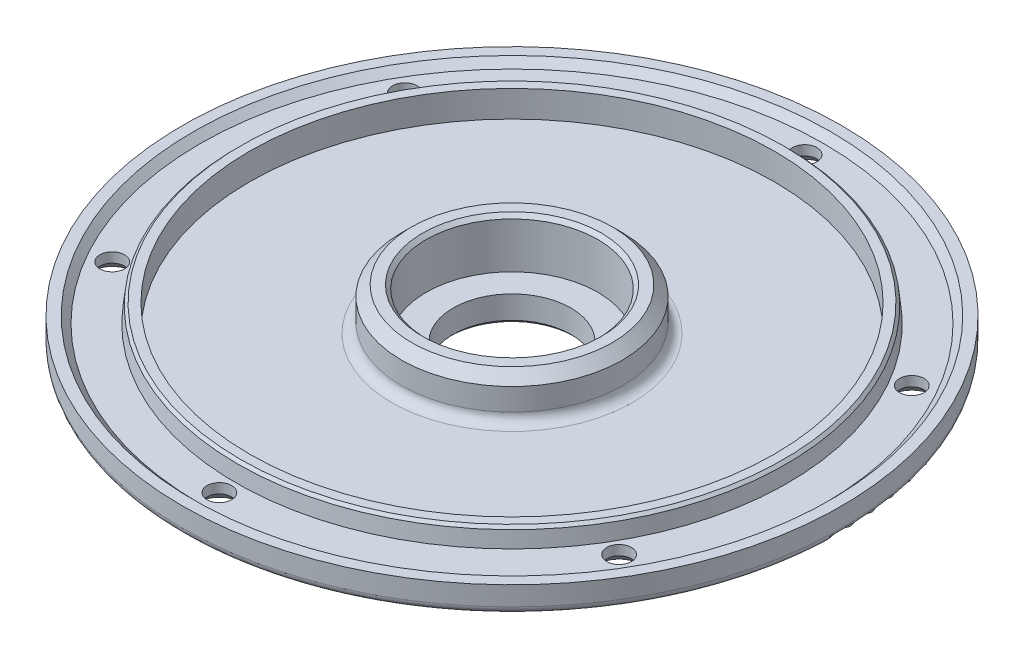
from build123d import *

# Parameters (mm, degrees)
ESQUISSE3_R                               = 2.5
ENL_V_MAT_EXTRU_1_DEPTH                   = 96.371497385
CHANFREIN1_SIZE                           = 2
R_P_TITION_CIRCULAIRE1_COUNT              = 6
CHANFREIN1_OF_R_P_TITION_CIRCULAIRE1_SIZE = 2


with BuildPart() as part:
    # Esquisse2 → Révolution1 (revolve)
    with BuildSketch(Plane.XY, mode=Mode.PRIVATE) as r_volution1_sk:
        with BuildLine():
            Line((-11.95, 56.6), (-17.45, 56.6))
            Line((-17.45, 56.6), (-17.45, 65.9))
            Line((-17.45, 65.9), (-18.2, 66.65))
            Line((-18.2, 66.65), (-20.4, 66.65))
            Line((-20.4, 66.65), (-22.45, 64.6))
            Line((-22.45, 64.6), (-22.45, 60.1))
            ThreePointArc((-22.45, 60.1), (-23.035786438, 58.685786438), (-24.45, 58.1))
            Line((-24.45, 58.1), (-53.35, 58.1))
            Line((-53.35, 58.1), (-53.35, 63.5))
            Line((-53.35, 63.5), (-55.2, 63.5))
            Line((-55.2, 63.5), (-55.75, 62.95))
            Line((-55.75, 62.95), (-56.1, 59.8))
            Line((-56.1, 59.8), (-63.4, 59.8))
            Line((-63.4, 59.8), (-64.8, 61.2))
            Line((-64.8, 61.2), (-67, 61.2))
            Line((-67, 61.2), (-67, 57.3))
            ThreePointArc((-67, 57.3), (-66.560660172, 56.239339828), (-65.5, 55.8))
            Line((-65.5, 55.8), (-21.9, 55.8))
            Line((-21.9, 55.8), (-15, 51.2))
            Line((-15, 51.2), (-12.7, 51.2))
            Line((-12.7, 51.2), (-11.95, 51.95))
            Line((-11.95, 51.95), (-11.95, 56.6))
        make_face()
    revolve(r_volution1_sk.sketch.rotate(Axis((0, 0, 0), (0, 1, 0)), 270), axis=Axis((0, 0, 0), (0, 1, 0)))

    # Esquisse3 → Enlèv. mat.-Extru.1 (cut, through all)
    with BuildSketch(Plane.XZ.offset(-55.8)):
        with Locations(Location((0, 59.5, 0), (0, 0, 270))):
            Circle(ESQUISSE3_R)
    enl_v_mat_extru_1 = extrude(amount=-ENL_V_MAT_EXTRU_1_DEPTH, mode=Mode.SUBTRACT)

    # Chanfrein1
    chanfrein1_edges = [part.edges().sort_by_distance(p)[0] for p in [
        (0, 55.8, 62),
    ]]
    chamfer(chanfrein1_edges, length=CHANFREIN1_SIZE)

    # Répétition circulaire1: Enlèv. mat.-Extru.1 ×6 about axis
    r_p_tition_circulaire1_axis = Axis((0, 0, 0), (0, 1, 0))
    for i in range(1, R_P_TITION_CIRCULAIRE1_COUNT):
        add(enl_v_mat_extru_1.rotate(r_p_tition_circulaire1_axis, i * 360 / R_P_TITION_CIRCULAIRE1_COUNT), mode=Mode.SUBTRACT)

    # Chanfrein1 of Répétition circulaire1
    chanfrein1_of_r_p_tition_circulaire1_edges = [part.edges().sort_by_distance(p)[0] for p in [
        (53.693575035, 55.8, 31),
        (53.693575035, 55.8, -31),
        (0, 55.8, -62),
        (-53.693575035, 55.8, -31),
        (-53.693575035, 55.8, 31),
    ]]
    chamfer(chanfrein1_of_r_p_tition_circulaire1_edges, length=CHANFREIN1_OF_R_P_TITION_CIRCULAIRE1_SIZE)


solid = part.part
